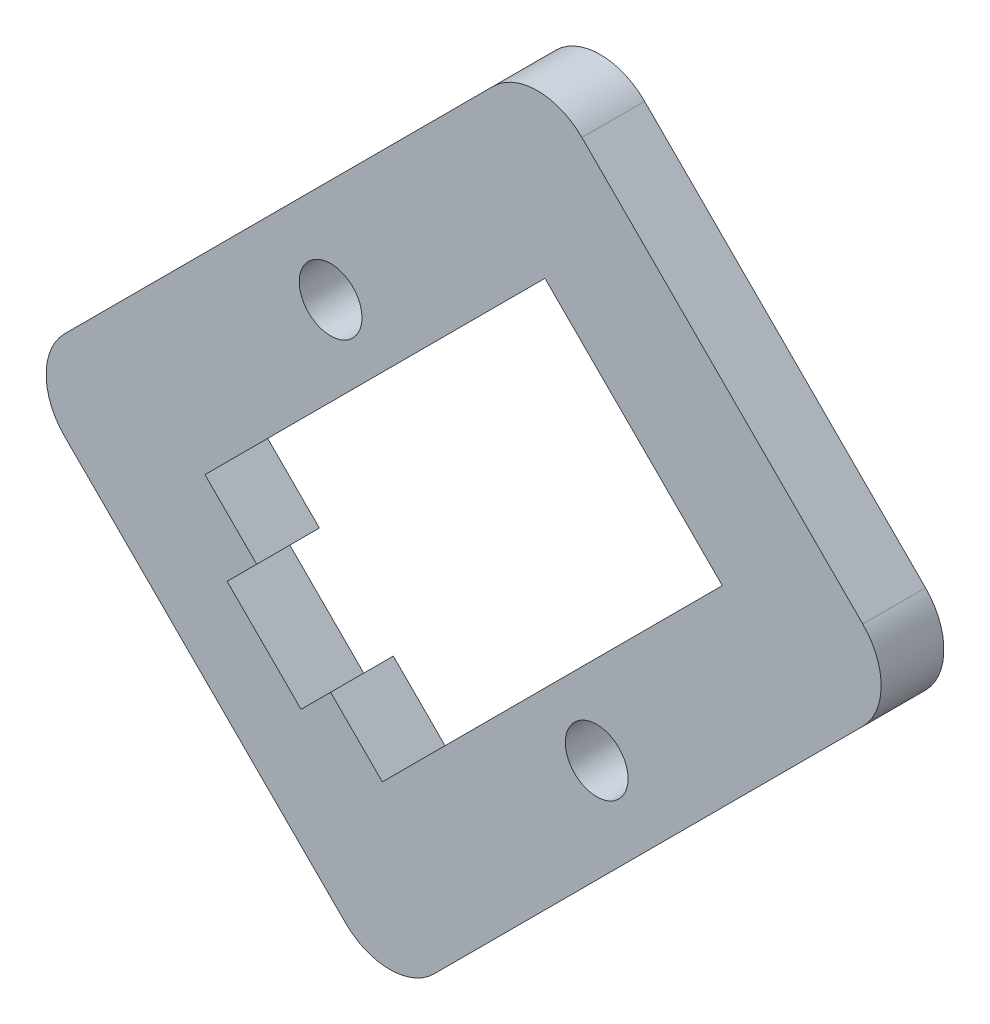
from build123d import *

# Parameters (mm, degrees)
SKETCH_1_R      = 1.500000002
EXTRUDE_1_DEPTH = 3


with BuildPart() as part:
    # 草圖1 → 填料-伸長1 (new body)
    with BuildSketch(Plane.XY):
        with BuildLine():
            Line((97.771620344, 7.23041011), (118.277716998, 27.736506765))
            ThreePointArc((118.277716998, 27.736506765), (119.156396654, 29.857827108), (118.277716998, 31.979147452))
            Line((118.277716998, 31.979147452), (104.842688155, 45.414176295))
            ThreePointArc((104.842688155, 45.414176295), (102.721367812, 46.292855951), (100.600047468, 45.414176295))
            Line((100.600047468, 45.414176295), (80.093950814, 24.90807964))
            ThreePointArc((80.093950814, 24.90807964), (79.215271157, 22.786759297), (80.093950814, 20.665438953))
            Line((80.093950814, 20.665438953), (93.528979656, 7.23041011))
            ThreePointArc((93.528979656, 7.23041011), (95.6503, 6.351730454), (97.771620344, 7.23041011))
        make_face()
        with Locations((105.549794939, 19.958332172)):
            Circle(SKETCH_1_R, mode=Mode.SUBTRACT)
        with Locations((92.821872878, 32.686254233)):
            Circle(SKETCH_1_R, mode=Mode.SUBTRACT)
        Polygon((91.407588602, 15.008513993), (92.821872875, 16.422798266), (95.296746609, 13.947924532), (111.560202577, 30.211380499), (103.074921202, 38.696661873), (86.811465235, 22.433205906), (89.286338969, 19.958332172), (87.872054696, 18.544047899), align=None, mode=Mode.SUBTRACT)
    extrude(amount=EXTRUDE_1_DEPTH)


solid = part.part
